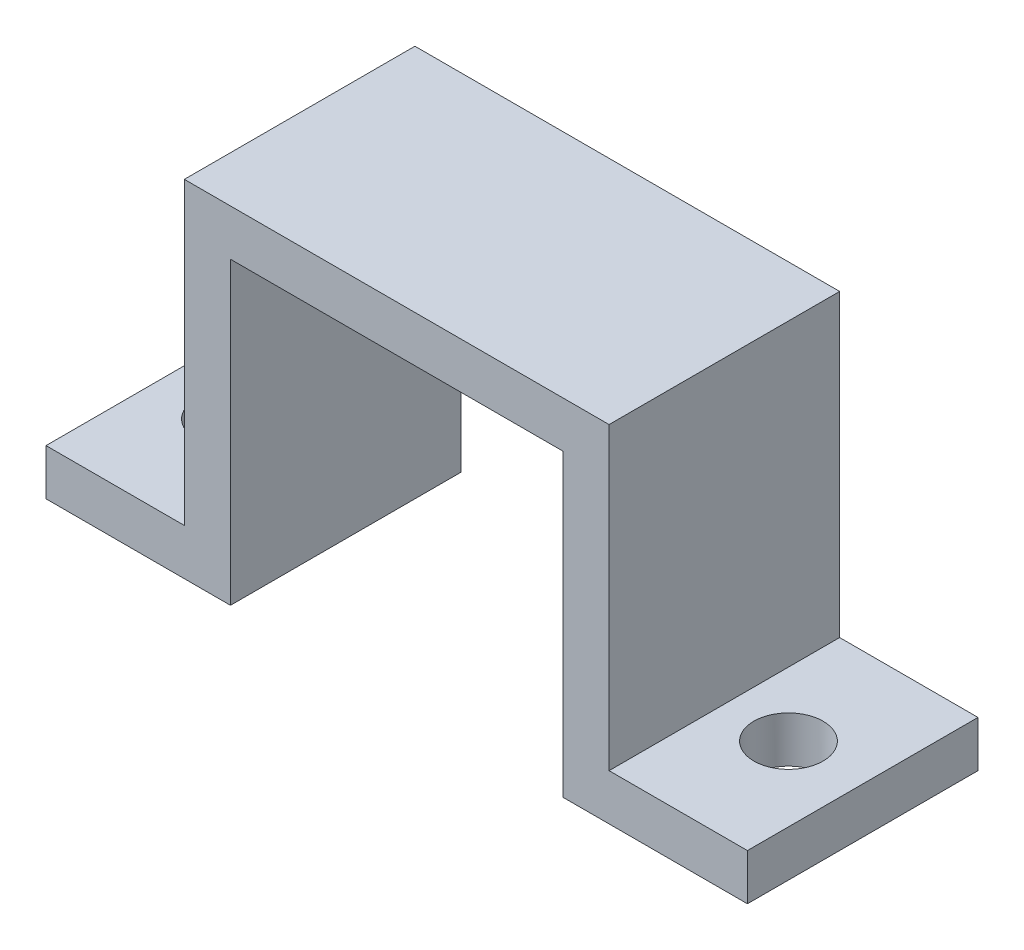
from build123d import *

# Parameters (mm, degrees)
BOSS_EXTRUDE1_DEPTH     = 10
CUT_EXTRUDE1_DEPTH      = 23.974660823
CUT_EXTRUDE1_DEPTH_BACK = 23.974660823
SKETCH2_R               = 1.5


with BuildPart() as part:
    # Sketch1 → Boss-Extrude1 (new body)
    with BuildSketch(Plane.XY):
        Polygon((-16.088351064, -3.521010638), (-16.088351064, -1.521010638), (-10.088351064, -1.521010638), (-10.088351064, 11.478989362), (8.331648936, 11.478989362), (8.331648936, -1.521010638), (14.331648936, -1.521010638), (14.331648936, -3.521010638), (6.331648936, -3.521010638), (6.331648936, 9.478989362), (-8.088351064, 9.478989362), (-8.088351064, -3.521010638), align=None)
    extrude(amount=BOSS_EXTRUDE1_DEPTH)

    # Sketch2 → Cut-Extrude1 (cut, two sides: drawn at the far end of the back side and taken through both)
    with BuildSketch(Plane(origin=(0, -1.521010638, 0), x_dir=(1, 0, 0), z_dir=(0, 1, 0)).offset(-CUT_EXTRUDE1_DEPTH_BACK)):
        with Locations(Location((-13.088351064, -5, 0), (0, 0, 270))):
            Circle(SKETCH2_R)
        with Locations(Location((11.112056512, -5, 0), (0, 0, 270))):
            Circle(SKETCH2_R)
    extrude(amount=CUT_EXTRUDE1_DEPTH + CUT_EXTRUDE1_DEPTH_BACK, mode=Mode.SUBTRACT)


solid = part.part
